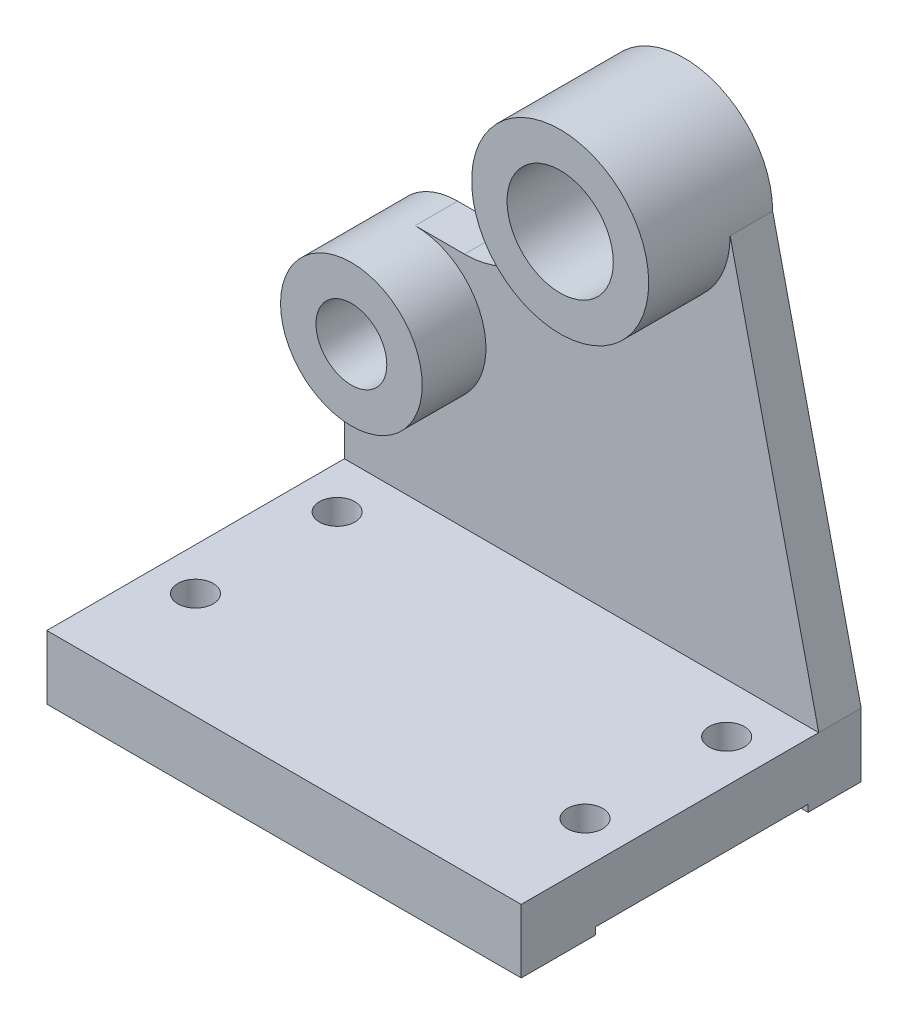
from build123d import *

# Parameters (mm, degrees)
SKETCH1_W               = 133.951426206
SKETCH1_H               = 18
BOSS_EXTRUDE1_DEPTH     = 96
BOSS_EXTRUDE2_DEPTH     = 12
SKETCH1_4_R             = 10
BOSS_EXTRUDE3_DEPTH     = 30
SKETCH1_5_R             = 15
BOSS_EXTRUDE4_DEPTH     = 35
CUT_EXTRUDE1_DEPTH      = 219.192540162
CUT_EXTRUDE1_DEPTH_BACK = 140
SKETCH2_W               = 60
SKETCH2_H               = 2
SKETCH4_R               = 5
CUT_EXTRUDE3_DEPTH      = 35
SKETCH5_R               = 5
CUT_EXTRUDE4_DEPTH      = 35


with BuildPart() as part:
    # Sketch1 → Boss-Extrude1 (new body)
    with BuildSketch(Plane.XY):
        Rectangle(SKETCH1_W, SKETCH1_H)
    extrude(amount=BOSS_EXTRUDE1_DEPTH)

    # Sketch1<3> → Boss-Extrude2 (add)
    with BuildSketch(Plane.XY):
        with BuildLine():
            Line((-66.975713103, 9), (66.975713103, 9))
            Line((66.975713103, 9), (41.975713103, 118))
            ThreePointArc((41.975713103, 118), (16.975713103, 93), (-8.024286897, 118))
            Line((-8.024286897, 118), (-8.024286897, 101))
            ThreePointArc((-8.024286897, 101), (-15.346617368, 83.32233047), (-33.024286897, 76))
            Line((-33.024286897, 76), (-46.975713103, 76))
            ThreePointArc((-46.975713103, 76), (-32.833577479, 70.142135624), (-26.975713103, 56))
            ThreePointArc((-26.975713103, 56), (-46.975713103, 36), (-66.975713103, 56))
            Line((-66.975713103, 56), (-66.975713103, 9))
        make_face()
    extrude(amount=BOSS_EXTRUDE2_DEPTH)

    # Sketch1<4> → Boss-Extrude3 (add)
    with BuildSketch(Plane.XY):
        with BuildLine():
            ThreePointArc((-46.975713103, 76), (-61.117848726, 70.142135624), (-66.975713103, 56))
            ThreePointArc((-66.975713103, 56), (-46.975713103, 36), (-26.975713103, 56))
            ThreePointArc((-26.975713103, 56), (-32.833577479, 70.142135624), (-46.975713103, 76))
        make_face()
        with Locations((-46.975713103, 56)):
            Circle(SKETCH1_4_R, mode=Mode.SUBTRACT)
    extrude(amount=BOSS_EXTRUDE3_DEPTH)

    # Sketch1<5> → Boss-Extrude4 (add)
    with BuildSketch(Plane.XY):
        with BuildLine():
            ThreePointArc((-8.024286897, 118), (16.975713103, 93), (41.975713103, 118))
            ThreePointArc((41.975713103, 118), (16.975713103, 143), (-8.024286897, 118))
        make_face()
        with Locations((16.975713103, 118)):
            Circle(SKETCH1_5_R, mode=Mode.SUBTRACT)
    extrude(amount=BOSS_EXTRUDE4_DEPTH)

    # Sketch2 → Cut-Extrude1 (cut, two sides: drawn at the far end of the back side and taken through both)
    with BuildSketch(Plane(origin=(66.975713103, 0, 0), x_dir=(0, 0, -1), z_dir=(1, 0, 0)).offset(-CUT_EXTRUDE1_DEPTH_BACK)):
        with Locations((-45, -8)):
            Rectangle(SKETCH2_W, SKETCH2_H)
    extrude(amount=CUT_EXTRUDE1_DEPTH + CUT_EXTRUDE1_DEPTH_BACK, mode=Mode.SUBTRACT)

    # Sketch4 → Cut-Extrude3 (cut)
    with BuildSketch(Plane(origin=(0, 9, 0), x_dir=(1, 0, 0), z_dir=(0, 1, 0))):
        with Locations((55, -26)):
            Circle(SKETCH4_R)
        with Locations((55, -66)):
            Circle(SKETCH4_R)
        with Locations((-55, -66)):
            Circle(SKETCH4_R)
    extrude(amount=-CUT_EXTRUDE3_DEPTH, mode=Mode.SUBTRACT)

    # Sketch5 → Cut-Extrude4 (cut)
    with BuildSketch(Plane(origin=(0, 9, 0), x_dir=(1, 0, 0), z_dir=(0, 1, 0))):
        with Locations((-55, -26)):
            Circle(SKETCH5_R)
    extrude(amount=-CUT_EXTRUDE4_DEPTH, mode=Mode.SUBTRACT)


solid = part.part
